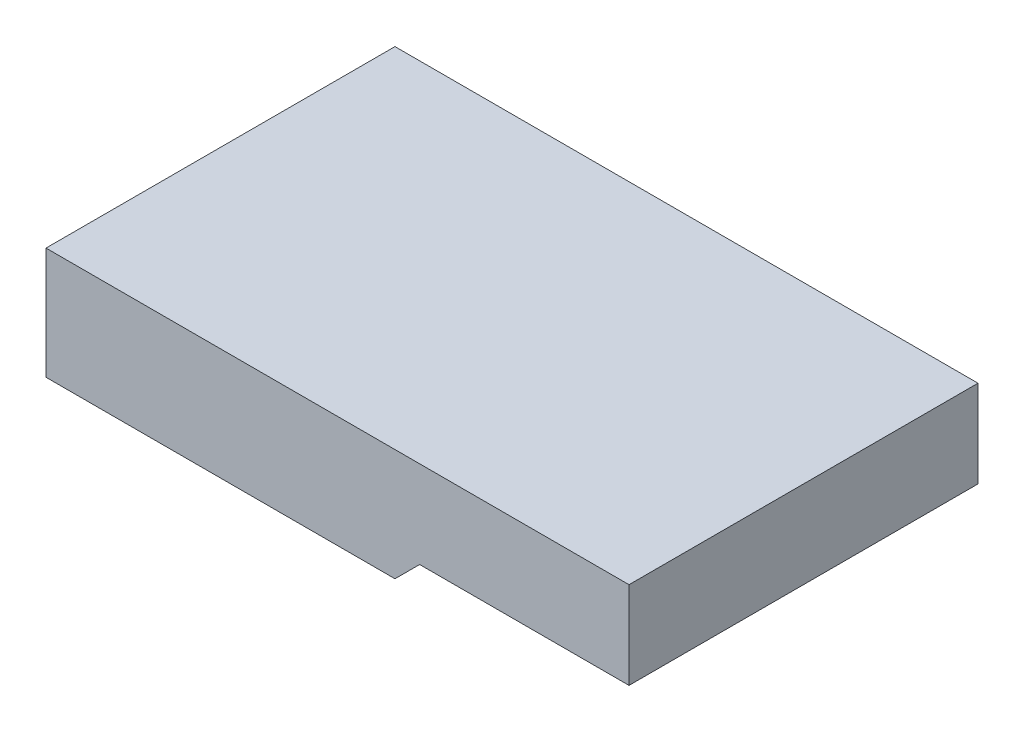
from build123d import *

# Parameters (mm, degrees)
BOSS_EXTRUDE1_DEPTH = 10


with BuildPart() as part:
    # Sketch1 → Boss-Extrude1 (new body)
    with BuildSketch(Plane.XY):
        Polygon((0, 0), (10, 0), (10.707106781, 0.707106781), (16.707106781, 0.707106781), (16.707106781, 3.207106781), (0, 3.207106781), align=None)
    extrude(amount=BOSS_EXTRUDE1_DEPTH)


solid = part.part
